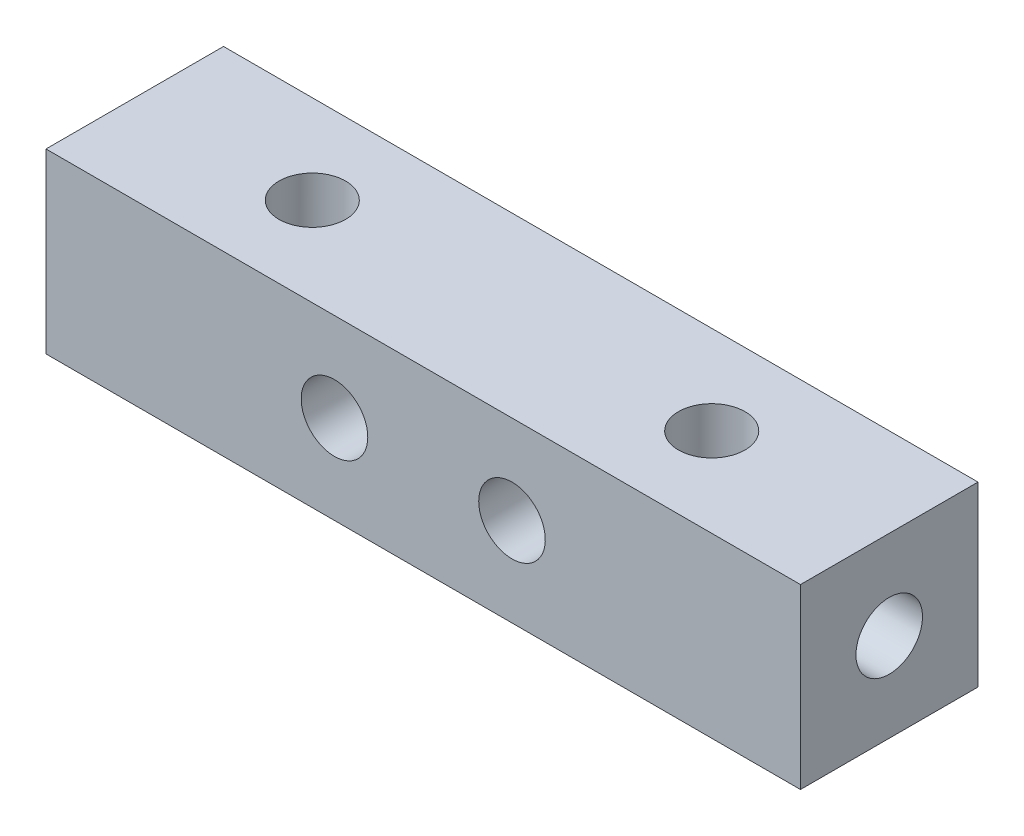
from build123d import *

# Parameters (mm, degrees)
SKETCH_1_W          = 34
SKETCH_1_H          = 8
SKETCH_1_R          = 1.5
EXTRUDE_1_DEPTH     = 8
SKETCH_2_R          = 1.5
CUT_EXTRUDE_1_DEPTH = 8
SKETCH_3_R          = 1.5
CUT_EXTRUDE_2_DEPTH = 39


with BuildPart() as part:
    # 草图1 → 凸台-拉伸1 (new body)
    with BuildSketch(Plane(origin=(0, 0, 0), x_dir=(1, 0, 0), z_dir=(0, 1, 0))):
        Rectangle(SKETCH_1_W, SKETCH_1_H)
        with Locations(Location((-9, 0, 0), (0, 0, 270))):
            Circle(SKETCH_1_R, mode=Mode.SUBTRACT)
        with Locations(Location((9, 0, 0), (0, 0, 270))):
            Circle(SKETCH_1_R, mode=Mode.SUBTRACT)
    extrude(amount=EXTRUDE_1_DEPTH)

    # 草图2 → 切除-拉伸1 (cut)
    with BuildSketch(Plane.XY.offset(4)):
        with Locations((-4, 4)):
            Circle(SKETCH_2_R)
        with Locations(Location((4, 4, 0), (0, 0, 180))):
            Circle(SKETCH_2_R)
    extrude(amount=-CUT_EXTRUDE_1_DEPTH, mode=Mode.SUBTRACT)

    # 草图3 → 切除-拉伸2 (cut)
    with BuildSketch(Plane.ZY.offset(17)):
        with Locations((0, 4)):
            Circle(SKETCH_3_R)
    extrude(amount=-CUT_EXTRUDE_2_DEPTH, mode=Mode.SUBTRACT)


solid = part.part
